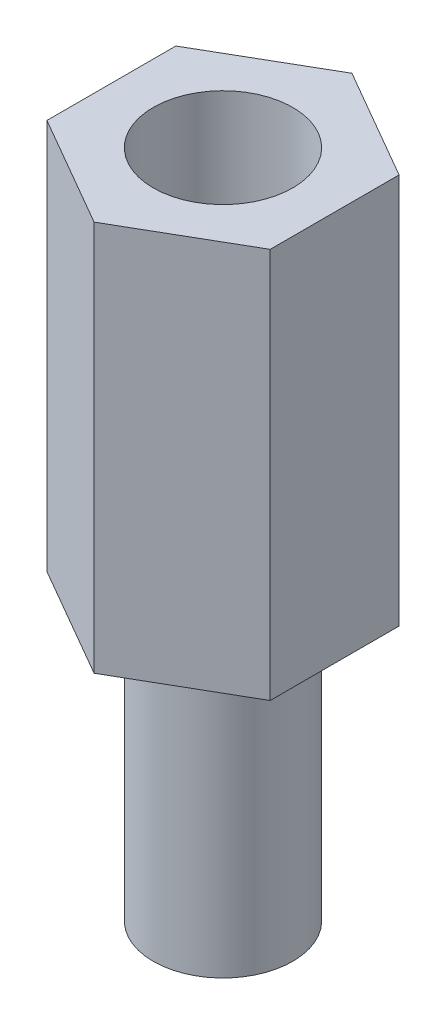
from build123d import *

# Parameters (mm, degrees)
BOSS_EXTRUDE1_DEPTH = 14
SKETCH1_3_R         = 2.5
BOSS_EXTRUDE2_DEPTH = 10
SKETCH3_R           = 2.5
CUT_EXTRUDE1_DEPTH  = 6


with BuildPart() as part:
    # Sketch1 → Boss-Extrude1 (new body)
    with BuildSketch(Plane(origin=(0, 0, 0), x_dir=(1, 0, 0), z_dir=(0, 1, 0))):
        Polygon((0, 4.618802154), (-4, 2.309401077), (-4, -2.309401077), (0, -4.618802154), (4, -2.309401077), (4, 2.309401077), align=None)
    extrude(amount=BOSS_EXTRUDE1_DEPTH)

    # Sketch1<3> → Boss-Extrude2 (add)
    with BuildSketch(Plane(origin=(0, 0, 0), x_dir=(1, 0, 0), z_dir=(0, 1, 0))):
        Circle(SKETCH1_3_R)
    extrude(amount=-BOSS_EXTRUDE2_DEPTH)

    # Sketch3 → Cut-Extrude1 (cut)
    with BuildSketch(Plane(origin=(0, 14, 0), x_dir=(1, 0, 0), z_dir=(0, 1, 0))):
        Circle(SKETCH3_R)
    extrude(amount=-CUT_EXTRUDE1_DEPTH, mode=Mode.SUBTRACT)


solid = part.part
